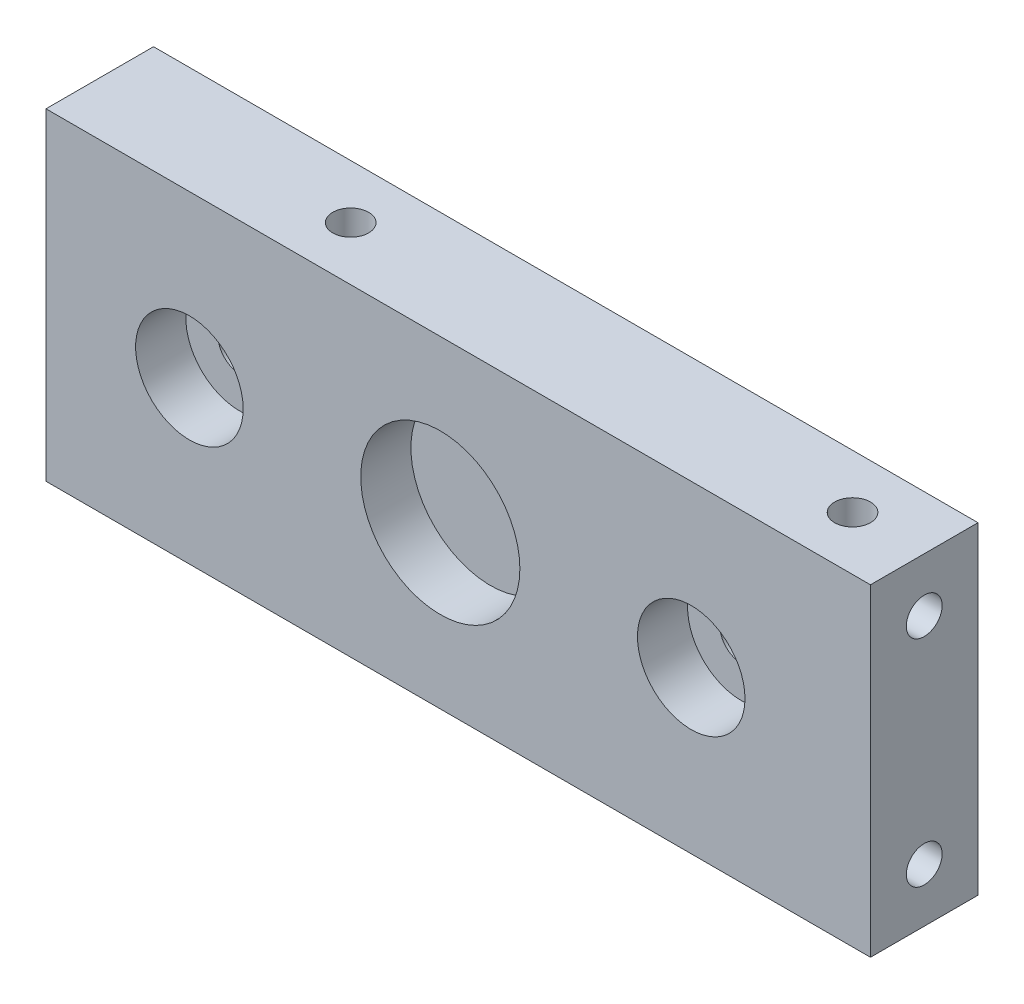
from build123d import *
from build123d.topology import SkipClean

# Parameters (mm, degrees)
SKETCH1_W           = 100
SKETCH1_H           = 45
SKETCH1_R           = 3
BOSS_EXTRUDE1_DEPTH = 15
SKETCH2_R           = 7.5
SKETCH2_R_2         = 11.1
CUT_EXTRUDE1_DEPTH  = 7
SKETCH4_W           = 15
SKETCH4_H           = 45
BOSS_EXTRUDE2_DEPTH = 10
SKETCH5_R           = 5.5
CUT_EXTRUDE2_DEPTH  = 5
SKETCH7_R           = 2.5
CUT_EXTRUDE4_DEPTH  = 10
SKETCH9_R           = 2.5
CUT_EXTRUDE6_DEPTH  = 10
SKETCH11_W          = 15
SKETCH11_H          = 45
SKETCH11_R          = 2.5
BOSS_EXTRUDE4_DEPTH = 5


with BuildPart() as part:
    # Sketch1 → Boss-Extrude1 (new body)
    with BuildSketch(Plane.XY):
        Rectangle(SKETCH1_W, SKETCH1_H)
        with Locations((-35, 0)):
            Circle(SKETCH1_R, mode=Mode.SUBTRACT)
        with Locations(Location((35, 0, 0), (0, 0, 180))):
            Circle(SKETCH1_R, mode=Mode.SUBTRACT)
    extrude(amount=BOSS_EXTRUDE1_DEPTH)

    # Sketch2 → Cut-Extrude1 (cut)
    with BuildSketch(Plane.XY.offset(15)):
        with Locations((-35, 0)):
            Circle(SKETCH2_R)
        with Locations((35, 0)):
            Circle(SKETCH2_R)
        Circle(SKETCH2_R_2)
    extrude(amount=-CUT_EXTRUDE1_DEPTH, mode=Mode.SUBTRACT)

    # Sketch4 → Boss-Extrude2 (add)
    with BuildSketch(Plane(origin=(50, 0, 0), x_dir=(0, 0, -1), z_dir=(1, 0, 0))):
        with Locations((-7.5, 0)):
            Rectangle(SKETCH4_W, SKETCH4_H)
    extrude(amount=BOSS_EXTRUDE2_DEPTH)

    # Sketch5 → Cut-Extrude2 (cut)
    with BuildSketch(Plane(origin=(0, 0, 0), x_dir=(-1, 0, 0), z_dir=(0, 0, -1))):
        with Locations((-35, 0)):
            Circle(SKETCH5_R)
        with Locations((35, 0)):
            Circle(SKETCH5_R)
    extrude(amount=-CUT_EXTRUDE2_DEPTH, mode=Mode.SUBTRACT)

    # Sketch7 → Cut-Extrude4 (cut)
    with BuildSketch(Plane.ZY.offset(50)):
        with Locations((7.5, 15)):
            Circle(SKETCH7_R)
        with Locations(Location((7.5, -15, 0), (0, 0, 180))):
            Circle(SKETCH7_R)
    cut_extrude4 = extrude(amount=-CUT_EXTRUDE4_DEPTH, mode=Mode.SUBTRACT)

    # Sketch9 → Cut-Extrude6 (cut)
    with BuildSketch(Plane(origin=(0, 22.5, 0), x_dir=(1, 0, 0), z_dir=(0, 1, 0))):
        with Locations(Location((-20, -7.5, 0), (0, 0, 270))):
            Circle(SKETCH9_R)
        with Locations(Location((50, -7.5, 0), (0, 0, 270))):
            Circle(SKETCH9_R)
    extrude(amount=-CUT_EXTRUDE6_DEPTH, mode=Mode.SUBTRACT)

    # Mirror1: Cut-Extrude4 across plane
    with SkipClean():  # the faces are left unmerged after this step: merging them gives an invalid solid
        add(cut_extrude4.mirror(Plane(origin=(5, 0, 0), x_dir=(0, 0, 1), z_dir=(1, 0, 0))), mode=Mode.SUBTRACT)

    # Sketch11 → Boss-Extrude4 (add)
    with SkipClean():  # the faces are left unmerged after this step: merging them gives an invalid solid
        with BuildSketch(Plane.ZY.offset(50)):
            with Locations((7.5, 0)):
                Rectangle(SKETCH11_W, SKETCH11_H)
            with Locations(Location((7.5, -15, 0), (0, 0, 180))):
                Circle(SKETCH11_R, mode=Mode.SUBTRACT)
            with Locations((7.5, 15)):
                Circle(SKETCH11_R, mode=Mode.SUBTRACT)
        extrude(amount=BOSS_EXTRUDE4_DEPTH)


solid = part.part
